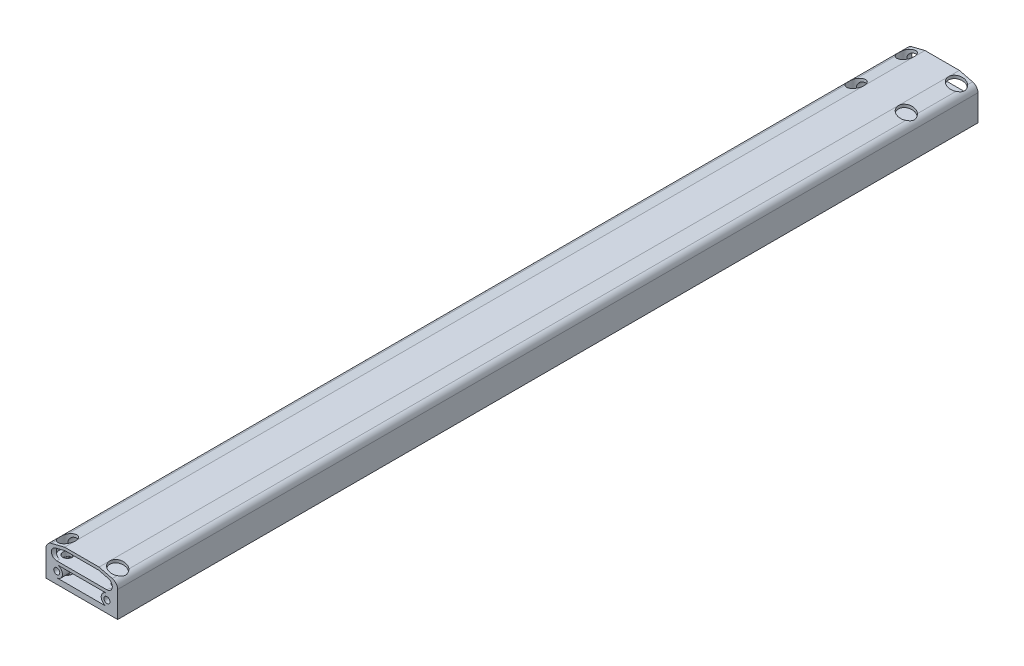
from build123d import *

# Parameters (mm, degrees)
SKETCH_1_W          = 50
SKETCH_1_H          = 25.2
EXTRUDE_1_DEPTH     = 300
CUT_EXTRUDE_1_DEPTH = 602.049116129
SKETCH_3_R          = 1.9
CUT_EXTRUDE_2_DEPTH = 602.049116129
M5X0_8_1_AT_2_COUNT = 2
M5X0_8_1_AT_2_PITCH = 35
CUT_EXTRUDE_3_REACH = 304.093
SKETCH_6_R          = 5.5
SKETCH_7_R          = 3.25
CUT_EXTRUDE_4_DEPTH = 302.374584305
CUT_EXTRUDE_5_DEPTH = 3


with BuildPart() as part:
    # 草图1 → 凸台-拉伸1 (new, symmetric)
    with BuildSketch(Plane.XY):
        with Locations((0, 12.6)):
            Rectangle(SKETCH_1_W, SKETCH_1_H)
    extrude(amount=EXTRUDE_1_DEPTH, both=True)

    # 草图2 → 切除-拉伸1 (cut, through all)
    with BuildSketch(Plane.XY.offset(300)):
        with BuildLine():
            Line((-12, 25.2), (-21.211807477, 22.903238439))
            ThreePointArc((-21.211807477, 22.903238439), (-23.896180828, 21.188142713), (-25, 18.2))
            Line((-25, 18.2), (-25, 25.2))
            Line((-25, 25.2), (-12, 25.2))
        make_face()
        with BuildLine():
            Line((25, 25.2), (12, 25.2))
            Line((12, 25.2), (21.211807477, 22.903238439))
            ThreePointArc((21.211807477, 22.903238439), (23.896180828, 21.188142713), (25, 18.2))
            Line((25, 18.2), (25, 25.2))
        make_face()
        with BuildLine():
            Line((-11.754430878, 23.2), (11.754430878, 23.2))
            Line((11.754430878, 23.2), (18.401568054, 21.542682563))
            ThreePointArc((18.401568054, 21.542682563), (21.198912414, 17.472521264), (17.5, 14.2))
            Line((17.5, 14.2), (-17.5, 14.2))
            ThreePointArc((-17.5, 14.2), (-21.198912414, 17.472521264), (-18.401568054, 21.542682563))
            Line((-18.401568054, 21.542682563), (-11.754430878, 23.2))
        make_face()
    extrude(amount=-CUT_EXTRUDE_1_DEPTH, mode=Mode.SUBTRACT)

    # 草图3 → 切除-拉伸2 (cut, through all)
    with BuildSketch(Plane.XY.offset(300)):
        with Locations((-17.5, 8)):
            Circle(SKETCH_3_R)
        with Locations(Location((17.5, 8, 0), (0, 0, 180))):
            Circle(SKETCH_3_R)
        with BuildLine():
            Line((-17.5, 12), (17.5, 12))
            ThreePointArc((17.5, 12), (13.5, 8), (17.5, 4))
            Line((17.5, 4), (-17.5, 4))
            ThreePointArc((-17.5, 4), (-13.5, 8), (-17.5, 12))
        make_face()
    extrude(amount=-CUT_EXTRUDE_2_DEPTH, mode=Mode.SUBTRACT)

    # 草图4 → M5x0.8 螺纹孔1 (revolve, cut)
    with BuildSketch(Plane(origin=(-17.5, 8, 300), x_dir=(0, -1, 0), z_dir=(1, 0, 0))):
        Polygon((0, 0), (0, 13.6618073), (2.1, 12.4), (2.1, 0), align=None)
    m5x0_8_1 = revolve(axis=Axis((-17.5, 8, 306.35), (0, 0, -1)), mode=Mode.SUBTRACT)

    # M5x0.8 螺纹孔1 at 2: M5x0.8 螺纹孔1 ×2
    with Locations(*[(i * M5X0_8_1_AT_2_PITCH, 0, 0) for i in range(1, M5X0_8_1_AT_2_COUNT)]):
        add(m5x0_8_1, mode=Mode.SUBTRACT)

    # 镜向1: M5x0.8 螺纹孔1 across plane
    add(m5x0_8_1.mirror(Plane.XY), mode=Mode.SUBTRACT)

    # 镜向1 copy 1 sketch → 镜向1 copy 1 (revolve, cut)
    with BuildSketch(Plane(origin=(17.5, 8, -300), x_dir=(0, -1, 0), z_dir=(1, 0, 0))):
        Polygon((0, 0), (0, -13.6618073), (2.1, -12.4), (2.1, 0), align=None)
    revolve(axis=Axis((17.5, 8, -306.35), (0, 0, -1)), mode=Mode.SUBTRACT)

    # 切除-拉伸3: up to this face of the body (flat: up to its plane)
    cut_extrude_3_end = Plane(part.part.faces().sort_by_distance((0, 14.2, 0))[0])
    # 草图6 → 切除-拉伸3 (cut, up to the picked face)
    with BuildSketch(Plane(origin=(0, 25.2, 0), x_dir=(1, 0, 0), z_dir=(0, 1, 0)), mode=Mode.PRIVATE) as cut_extrude_3_sk1:
        with Locations(Location((-17.5, 292.5, 0), (0, 0, 270))):
            Circle(SKETCH_6_R)
    cut_extrude_3_tool1 = split(extrude(cut_extrude_3_sk1.sketch, amount=-CUT_EXTRUDE_3_REACH, mode=Mode.PRIVATE), bisect_by=cut_extrude_3_end, keep=Keep.BOTH, mode=Mode.PRIVATE)
    # 草图6 → 切除-拉伸3 (cut, up to the picked face)
    with BuildSketch(Plane(origin=(0, 25.2, 0), x_dir=(1, 0, 0), z_dir=(0, 1, 0)), mode=Mode.PRIVATE) as cut_extrude_3_sk2:
        with Locations(Location((-17.5, 257.5, 0), (0, 0, 270))):
            Circle(SKETCH_6_R)
    cut_extrude_3_tool2 = split(extrude(cut_extrude_3_sk2.sketch, amount=-CUT_EXTRUDE_3_REACH, mode=Mode.PRIVATE), bisect_by=cut_extrude_3_end, keep=Keep.BOTH, mode=Mode.PRIVATE)
    # 草图6 → 切除-拉伸3 (cut, up to the picked face)
    with BuildSketch(Plane(origin=(0, 25.2, 0), x_dir=(1, 0, 0), z_dir=(0, 1, 0)), mode=Mode.PRIVATE) as cut_extrude_3_sk3:
        with Locations(Location((-17.5, -292.5, 0), (0, 0, 270))):
            Circle(SKETCH_6_R)
    cut_extrude_3_tool3 = split(extrude(cut_extrude_3_sk3.sketch, amount=-CUT_EXTRUDE_3_REACH, mode=Mode.PRIVATE), bisect_by=cut_extrude_3_end, keep=Keep.BOTH, mode=Mode.PRIVATE)
    # 草图6 → 切除-拉伸3 (cut, up to the picked face)
    with BuildSketch(Plane(origin=(0, 25.2, 0), x_dir=(1, 0, 0), z_dir=(0, 1, 0)), mode=Mode.PRIVATE) as cut_extrude_3_sk4:
        with Locations(Location((17.5, -292.5, 0), (0, 0, 270))):
            Circle(SKETCH_6_R)
    cut_extrude_3_tool4 = split(extrude(cut_extrude_3_sk4.sketch, amount=-CUT_EXTRUDE_3_REACH, mode=Mode.PRIVATE), bisect_by=cut_extrude_3_end, keep=Keep.BOTH, mode=Mode.PRIVATE)
    # 草图6 → 切除-拉伸3 (cut, up to the picked face)
    with BuildSketch(Plane(origin=(0, 25.2, 0), x_dir=(1, 0, 0), z_dir=(0, 1, 0)), mode=Mode.PRIVATE) as cut_extrude_3_sk5:
        with Locations(Location((17.5, 257.5, 0), (0, 0, 270))):
            Circle(SKETCH_6_R)
    cut_extrude_3_tool5 = split(extrude(cut_extrude_3_sk5.sketch, amount=-CUT_EXTRUDE_3_REACH, mode=Mode.PRIVATE), bisect_by=cut_extrude_3_end, keep=Keep.BOTH, mode=Mode.PRIVATE)
    # 草图6 → 切除-拉伸3 (cut, up to the picked face)
    with BuildSketch(Plane(origin=(0, 25.2, 0), x_dir=(1, 0, 0), z_dir=(0, 1, 0)), mode=Mode.PRIVATE) as cut_extrude_3_sk6:
        with Locations(Location((17.5, 292.5, 0), (0, 0, 270))):
            Circle(SKETCH_6_R)
    cut_extrude_3_tool6 = split(extrude(cut_extrude_3_sk6.sketch, amount=-CUT_EXTRUDE_3_REACH, mode=Mode.PRIVATE), bisect_by=cut_extrude_3_end, keep=Keep.BOTH, mode=Mode.PRIVATE)
    add(cut_extrude_3_tool1.solids().sort_by(Axis((-17.5, 25.2, -292.5), (0, -1, 0)))[0], mode=Mode.SUBTRACT)
    add(cut_extrude_3_tool2.solids().sort_by(Axis((-17.5, 25.2, -257.5), (0, -1, 0)))[0], mode=Mode.SUBTRACT)
    add(cut_extrude_3_tool3.solids().sort_by(Axis((-17.5, 25.2, 292.5), (0, -1, 0)))[0], mode=Mode.SUBTRACT)
    add(cut_extrude_3_tool4.solids().sort_by(Axis((17.5, 25.2, 292.5), (0, -1, 0)))[0], mode=Mode.SUBTRACT)
    add(cut_extrude_3_tool5.solids().sort_by(Axis((17.5, 25.2, -257.5), (0, -1, 0)))[0], mode=Mode.SUBTRACT)
    add(cut_extrude_3_tool6.solids().sort_by(Axis((17.5, 25.2, -292.5), (0, -1, 0)))[0], mode=Mode.SUBTRACT)

    # 草图7 → 切除-拉伸4 (cut, through all)
    with BuildSketch(Plane(origin=(0, 14.2, 0), x_dir=(1, 0, 0), z_dir=(0, 1, 0))):
        with Locations(Location((-17.5, 292.5, 0), (0, 0, 270))):
            Circle(SKETCH_7_R)
        with Locations(Location((-17.5, 257.5, 0), (0, 0, 270))):
            Circle(SKETCH_7_R)
        with Locations(Location((-17.5, -292.5, 0), (0, 0, 270))):
            Circle(SKETCH_7_R)
        with Locations(Location((17.5, -292.5, 0), (0, 0, 270))):
            Circle(SKETCH_7_R)
        with Locations(Location((17.5, 257.5, 0), (0, 0, 270))):
            Circle(SKETCH_7_R)
        with Locations(Location((17.5, 292.5, 0), (0, 0, 270))):
            Circle(SKETCH_7_R)
    extrude(amount=-CUT_EXTRUDE_4_DEPTH, mode=Mode.SUBTRACT)

    # 草图8 → 切除-拉伸5 (cut)
    with BuildSketch(Plane.XZ):
        with BuildLine():
            Line((-10, -300), (-10, -250))
            ThreePointArc((-10, -250), (0, -240), (10, -250))
            Line((10, -250), (10, -300))
            ThreePointArc((10, -300), (0, -310), (-10, -300))
        make_face()
    extrude(amount=-CUT_EXTRUDE_5_DEPTH, mode=Mode.SUBTRACT)


solid = part.part
